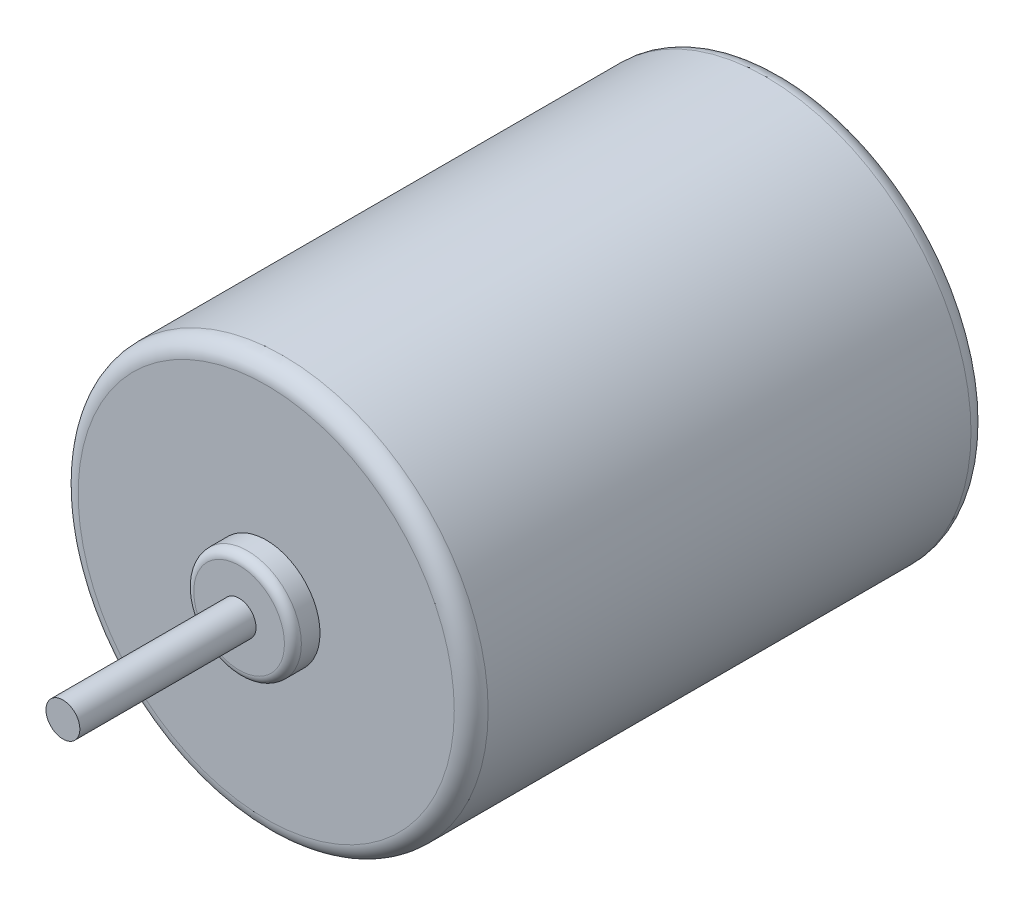
from build123d import *

# Parameters (mm, degrees)
SKETCH1_R           = 12.1
BOSS_EXTRUDE1_DEPTH = 30.5
SKETCH2_R           = 3.175
BOSS_EXTRUDE2_DEPTH = 1.6
SKETCH3_R           = 1
BOSS_EXTRUDE3_DEPTH = 10.4
SKETCH4_R           = 4.25
BOSS_EXTRUDE4_DEPTH = 2
FILLET1_R           = 1
FILLET2_R           = 0.5


with BuildPart() as part:
    # Sketch1 → Boss-Extrude1 (new body)
    with BuildSketch(Plane.XY):
        with Locations(Location((0, 0, 0), (0, 0, 180))):
            Circle(SKETCH1_R)
    extrude(amount=BOSS_EXTRUDE1_DEPTH)

    # Sketch2 → Boss-Extrude2 (add)
    with BuildSketch(Plane.XY.offset(30.5)):
        Circle(SKETCH2_R)
    extrude(amount=BOSS_EXTRUDE2_DEPTH)

    # Sketch3 → Boss-Extrude3 (add)
    with BuildSketch(Plane.XY.offset(32.1)):
        Circle(SKETCH3_R)
    extrude(amount=BOSS_EXTRUDE3_DEPTH)

    # Sketch4 → Boss-Extrude4 (add)
    with BuildSketch(Plane(origin=(0, 0, 0), x_dir=(-1, 0, 0), z_dir=(0, 0, -1))):
        with Locations(Location((0, 0, 0), (0, 0, 180))):
            Circle(SKETCH4_R)
    extrude(amount=BOSS_EXTRUDE4_DEPTH)

    # Fillet1
    fillet1_edges = [part.edges().sort_by_distance(p)[0] for p in [
        (12.1, 0, 0),
        (12.1, 0, 30.5),
    ]]
    fillet(fillet1_edges, radius=FILLET1_R)

    # Fillet2
    fillet2_edges = [part.edges().sort_by_distance(p)[0] for p in [
        (-4.25, 0, -2),
        (-3.175, 0, 32.1),
    ]]
    fillet(fillet2_edges, radius=FILLET2_R)


solid = part.part
